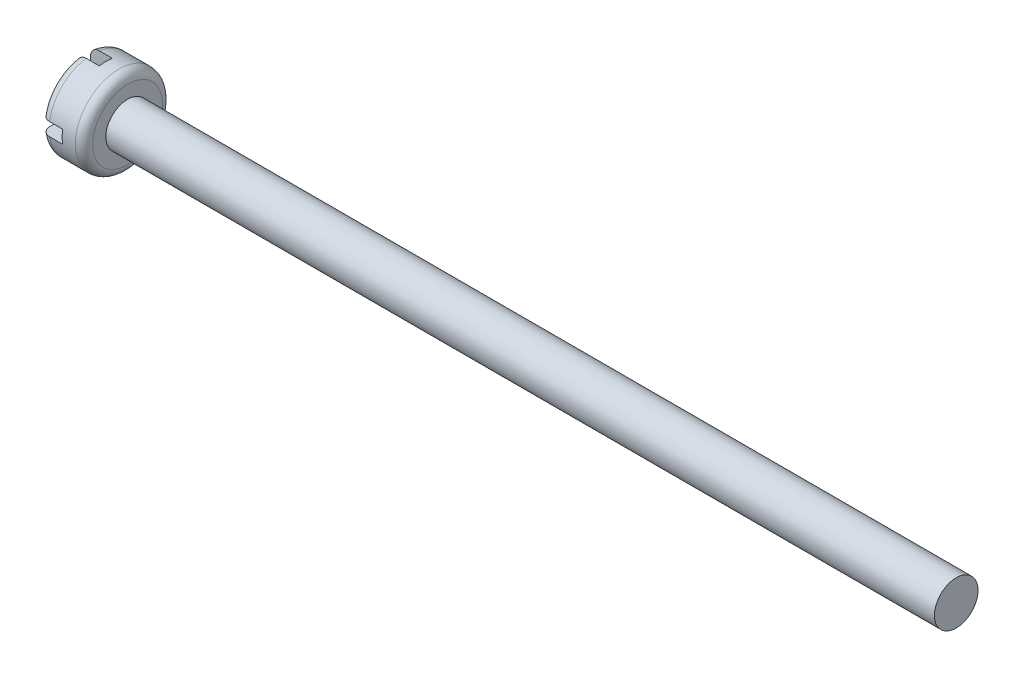
from build123d import *

# Parameters (mm, degrees)
SKETCH2_W          = 2
SKETCH2_H          = 0.3
SKETCH2_W_2        = 0.3
SKETCH2_H_2        = 2
CUT_EXTRUDE1_DEPTH = 0.5


with BuildPart() as part:
    # Sketch1 → Revolve1 (revolve)
    with BuildSketch(Plane.XY, mode=Mode.PRIVATE) as revolve1_sk:
        with BuildLine():
            Line((0, 0.8), (0, 0))
            Line((0, 0), (20, 0))
            Line((20, 0), (20, 0.5))
            Line((20, 0.5), (1, 0.5))
            Line((1, 0.5), (1, 0.8))
            ThreePointArc((1, 0.8), (0.941421356, 0.941421356), (0.8, 1))
            Line((0.8, 1), (0.2, 1))
            ThreePointArc((0.2, 1), (0.058578644, 0.941421356), (0, 0.8))
        make_face()
    revolve(revolve1_sk.sketch.rotate(Axis((0, 0, 0), (1, 0, 0)), 90), axis=Axis((0, 0, 0), (1, 0, 0)))

    # Sketch2 → Cut-Extrude1 (cut)
    with BuildSketch(Plane.ZY):
        Rectangle(SKETCH2_W, SKETCH2_H)
        Rectangle(SKETCH2_W_2, SKETCH2_H_2)
    extrude(amount=-CUT_EXTRUDE1_DEPTH, mode=Mode.SUBTRACT)


solid = part.part
